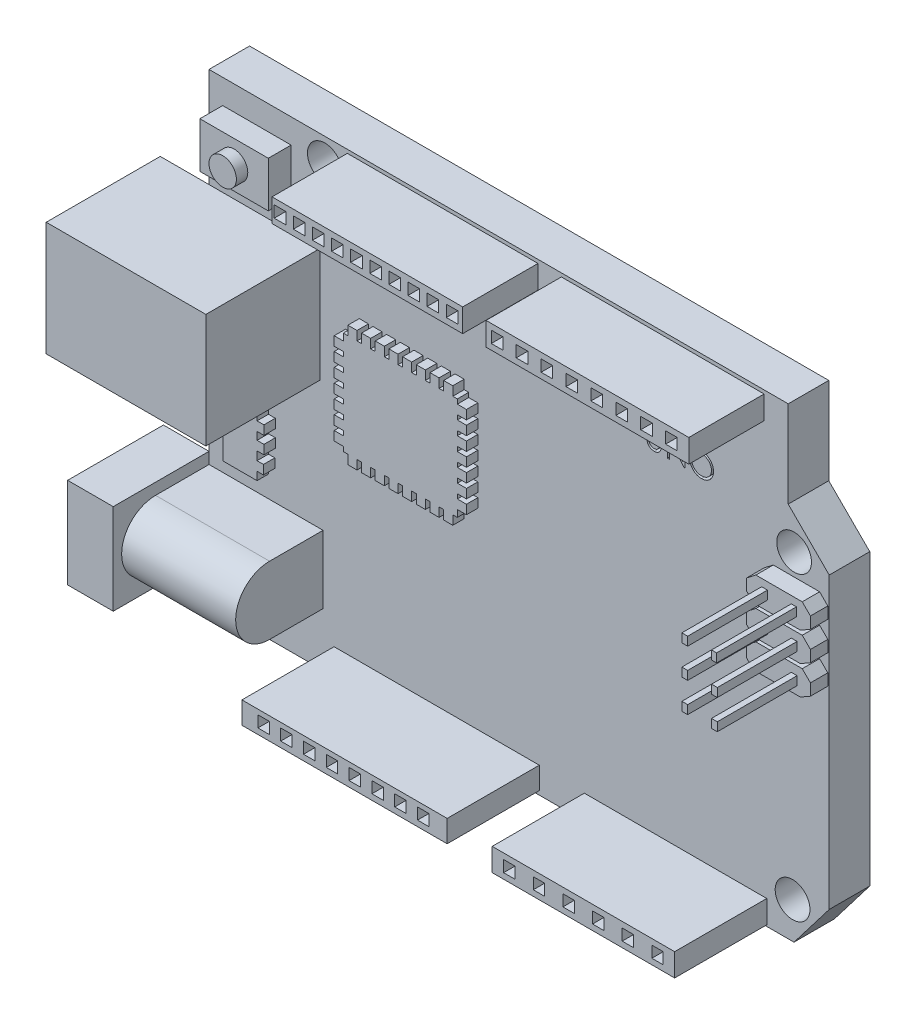
from build123d import *

# Parameters (mm, degrees)
BOSS_EXTRUDE1_DEPTH       = 1.778
CUT_EXTRUDE6_DEPTH        = 6.35
CUT_EXTRUDE6_DEPTH_BACK   = 7.874
SKETCH2_R                 = 0.762
BOSS_EXTRUDE5_DEPTH       = 2.54
SKETCH8_W                 = 8.89
SKETCH8_H                 = 1.016
SKETCH8_W_2               = 0.508
SKETCH8_H_2               = 0.508
SKETCH8_W_3               = 8.360268533
BOSS_EXTRUDE10_DEPTH      = 5.08
SKETCH9_W                 = 0.254
SKETCH9_H                 = 0.381
SKETCH9_W_2               = 0.224
BOSS_EXTRUDE14_DEPTH      = 3.5
SKETCH10_W                = 3
SKETCH10_H                = 2
BOSS_EXTRUDE15_DEPTH      = 1
SKETCH11_R                = 0.6
BOSS_EXTRUDE16_DEPTH      = 0.5
SKETCH21_W                = 7
SKETCH21_H                = 5
BOSS_EXTRUDE20_DEPTH      = 5
CUT_EXTRUDE9_DEPTH        = 6
SKETCH23_W                = 0.676458164
SKETCH23_H                = 1.161684227
BOSS_EXTRUDE21_DEPTH      = 6
BOSS_EXTRUDE22_DEPTH      = 0.5
BOSS_EXTRUDE25_DEPTH      = 1
BOSS_EXTRUDE25_DEPTH_BACK = 21
CUT_EXTRUDE10_START       = -17
CUT_EXTRUDE10_DEPTH       = 17
SKETCH32_W                = 4.2
SKETCH32_H                = 3.973735186
BOSS_EXTRUDE26_DEPTH      = 2
SKETCH33_R                = 1.3
CUT_EXTRUDE11_DEPTH       = 2
BOSS_EXTRUDE27_DEPTH      = 0.04
BOSS_EXTRUDE27_DEPTH_BACK = 2
SKETCH35_R                = 0.2
SKETCH36_W                = 8
SKETCH36_H                = 1
SKETCH36_W_2              = 0.5
SKETCH36_H_2              = 0.5
BOSS_EXTRUDE28_DEPTH      = 4.04
SKETCH39_W                = 9
SKETCH39_H                = 0.965136864
SKETCH39_W_2              = 0.5
SKETCH39_H_2              = 0.5
BOSS_EXTRUDE29_DEPTH      = 4.04
CUT_EXTRUDE15_DEPTH       = 0.5
BOSS_EXTRUDE30_DEPTH      = 0.5


with BuildPart() as part:
    # Sketch1 → Boss-Extrude1 (new body)
    with BuildSketch(Plane.XY):
        Polygon((-21.001524752, 8.06009901), (-21.001524752, -12.25990099), (4.652475248, -12.25990099), (6.197009901, -10.243465347), (6.197009901, 2.456534653), (4.398475248, 4.25009901), (4.398475248, 8.06009901), align=None)
    extrude(amount=BOSS_EXTRUDE1_DEPTH)

    # Sketch2 → Cut-Extrude6 (cut, two sides: drawn at the far end of the back side and taken through both)
    with BuildSketch(Plane.XY.offset(-CUT_EXTRUDE6_DEPTH_BACK)):
        with Locations((4.657234914, 2.557197453)):
            Circle(SKETCH2_R)
        with Locations((-15.921524752, 7.04409901)):
            Circle(SKETCH2_R)
        with Locations((-18.461524752, -11.24390099)):
            Circle(SKETCH2_R)
        with Locations((4.589010092, -10.671936231)):
            Circle(SKETCH2_R)
    extrude(amount=CUT_EXTRUDE6_DEPTH + CUT_EXTRUDE6_DEPTH_BACK, mode=Mode.SUBTRACT)

    # Sketch7 → Boss-Extrude5 (add)
    with BuildSketch(Plane.XY):
        Polygon((3.743027491, 1.610457136), (5.775027491, 1.610457136), (6.134237736, 1.251246892), (6.134237736, 0.743246892), (5.692767379, 0.491914593), (3.641234914, 0.491914593), (3.340205146, 0.79294436), (3.340205146, 1.30094436), align=None)
        Polygon((3.340205146, 0.03094436), (3.743027491, 0.340457136), (5.775027491, 0.340457136), (6.134237736, -0.018753108), (6.134237736, -0.526753108), (5.692767379, -0.778085407), (3.641234914, -0.778085407), (3.340205146, -0.47705564), align=None)
        Polygon((3.340205146, -1.23905564), (3.743027491, -0.929542864), (5.775027491, -0.929542864), (6.134237736, -1.288753108), (6.134237736, -1.796753108), (5.692767379, -2.048085407), (3.641234914, -2.048085407), (3.340205146, -1.74705564), align=None)
    extrude(amount=BOSS_EXTRUDE5_DEPTH)

    # Sketch8 → Boss-Extrude10 (add)
    # profile 1 of 2: a face of its own
    with BuildSketch(Plane.XY):
        with Locations((-1.103862224, 7.39657912)):
            Rectangle(SKETCH8_W, SKETCH8_H)
        with Locations((1.486937776, 7.39657912)):
            Rectangle(SKETCH8_W_2, SKETCH8_H_2, mode=Mode.SUBTRACT)
        with Locations((2.579137776, 7.39657912)):
            Rectangle(SKETCH8_W_2, SKETCH8_H_2, mode=Mode.SUBTRACT)
        with Locations((0.394737776, 7.39657912)):
            Rectangle(SKETCH8_W_2, SKETCH8_H_2, mode=Mode.SUBTRACT)
        with Locations((-0.697462224, 7.39657912)):
            Rectangle(SKETCH8_W_2, SKETCH8_H_2, mode=Mode.SUBTRACT)
        with Locations((-1.789662224, 7.39657912)):
            Rectangle(SKETCH8_W_2, SKETCH8_H_2, mode=Mode.SUBTRACT)
        with Locations((-2.881862224, 7.39657912)):
            Rectangle(SKETCH8_W_2, SKETCH8_H_2, mode=Mode.SUBTRACT)
        with Locations((-3.974062224, 7.39657912)):
            Rectangle(SKETCH8_W_2, SKETCH8_H_2, mode=Mode.SUBTRACT)
        with Locations((-5.066262224, 7.39657912)):
            Rectangle(SKETCH8_W_2, SKETCH8_H_2, mode=Mode.SUBTRACT)
    # profile 2 of 2: a face of its own
    with BuildSketch(Plane.XY):
        with Locations((-10.754714957, 7.39657912)):
            Rectangle(SKETCH8_W_3, SKETCH8_H)
        with Locations((-7.879854404, 7.39657912)):
            Rectangle(SKETCH8_W_2, SKETCH8_H_2, mode=Mode.SUBTRACT)
        with Locations((-7.041654404, 7.39657912)):
            Rectangle(SKETCH8_W_2, SKETCH8_H_2, mode=Mode.SUBTRACT)
        with Locations((-8.718054404, 7.39657912)):
            Rectangle(SKETCH8_W_2, SKETCH8_H_2, mode=Mode.SUBTRACT)
        with Locations((-9.556254404, 7.39657912)):
            Rectangle(SKETCH8_W_2, SKETCH8_H_2, mode=Mode.SUBTRACT)
        with Locations((-10.394454404, 7.39657912)):
            Rectangle(SKETCH8_W_2, SKETCH8_H_2, mode=Mode.SUBTRACT)
        with Locations((-11.232654404, 7.39657912)):
            Rectangle(SKETCH8_W_2, SKETCH8_H_2, mode=Mode.SUBTRACT)
        with Locations((-12.070854404, 7.39657912)):
            Rectangle(SKETCH8_W_2, SKETCH8_H_2, mode=Mode.SUBTRACT)
        with Locations((-12.909054404, 7.39657912)):
            Rectangle(SKETCH8_W_2, SKETCH8_H_2, mode=Mode.SUBTRACT)
        with Locations((-13.747254404, 7.39657912)):
            Rectangle(SKETCH8_W_2, SKETCH8_H_2, mode=Mode.SUBTRACT)
        with Locations((-14.585454404, 7.39657912)):
            Rectangle(SKETCH8_W_2, SKETCH8_H_2, mode=Mode.SUBTRACT)
    extrude(amount=BOSS_EXTRUDE10_DEPTH)

    # Sketch9 → Boss-Extrude14 (add)
    with BuildSketch(Plane.XY.offset(2.54)):
        with Locations((4.124027491, 1.102457136)):
            Rectangle(SKETCH9_W, SKETCH9_H)
        with Locations((5.409027491, 1.102457136)):
            Rectangle(SKETCH9_W_2, SKETCH9_H)
        with Locations((5.424027491, -0.197542864)):
            Rectangle(SKETCH9_W, SKETCH9_H)
        with Locations((4.124027491, -0.197542864)):
            Rectangle(SKETCH9_W, SKETCH9_H)
        with Locations((5.424027491, -1.497542864)):
            Rectangle(SKETCH9_W, SKETCH9_H)
        with Locations((4.124027491, -1.497542864)):
            Rectangle(SKETCH9_W, SKETCH9_H)
    extrude(amount=BOSS_EXTRUDE14_DEPTH)

    # Sketch10 → Boss-Extrude15 (add)
    with BuildSketch(Plane.XY.offset(1.778)):
        with Locations((-18.901524752, 5.986925815)):
            Rectangle(SKETCH10_W, SKETCH10_H)
    extrude(amount=BOSS_EXTRUDE15_DEPTH)

    # Sketch11 → Boss-Extrude16 (add)
    with BuildSketch(Plane.XY.offset(2.778)):
        with Locations((-18.901524752, 5.986925815)):
            Circle(SKETCH11_R)
    extrude(amount=BOSS_EXTRUDE16_DEPTH)

    # Sketch21 → Boss-Extrude20 (add)
    with BuildSketch(Plane.XY.offset(1.778)):
        with Locations((-19.640020469, 1.186961581)):
            Rectangle(SKETCH21_W, SKETCH21_H)
    extrude(amount=BOSS_EXTRUDE20_DEPTH)

    # Sketch22 → Cut-Extrude9 (cut)
    with BuildSketch(Plane.ZY.offset(23.140020469)):
        Polygon((5.444113885, 2.109424234), (5.444113885, 0.255118082), (4.630647808, -0.558347995), (3.111886115, -0.558347995), (3.111886115, 2.941652005), (4.611886115, 2.941652005), align=None)
    extrude(amount=-CUT_EXTRUDE9_DEPTH, mode=Mode.SUBTRACT)

    # Sketch23 → Boss-Extrude21 (add)
    with BuildSketch(Plane.ZY.offset(17.140020469)):
        with Locations((4.244276373, 1.191652005)):
            Rectangle(SKETCH23_W, SKETCH23_H)
    extrude(amount=BOSS_EXTRUDE21_DEPTH)

    # Sketch25 → Boss-Extrude22 (add)
    with BuildSketch(Plane.XY.offset(1.778)):
        Polygon((-19.894913407, -3.505326172), (-18.394913407, -3.505326172), (-18.394913407, -3.734159588), (-18.094167162, -3.734159588), (-18.094167162, -4.134159588), (-18.394913407, -4.134159588), (-18.394913407, -4.473424948), (-18.091551068, -4.473424948), (-18.091551068, -4.873424948), (-18.394913407, -4.873424948), (-18.394913407, -5.248183315), (-18.114536021, -5.248183315), (-18.114536021, -5.648183315), (-18.394913407, -5.648183315), (-18.394913407, -6.005326172), (-19.894913407, -6.005326172), align=None)
    extrude(amount=BOSS_EXTRUDE22_DEPTH)

    # Sketch30 → Boss-Extrude25 (add, two sides: drawn at the far end of the back side and taken through both)
    with BuildSketch(Plane(origin=(0, 0, 0), x_dir=(0, 0, -1), z_dir=(1, 0, 0)).offset(-BOSS_EXTRUDE25_DEPTH_BACK)):
        with BuildLine():
            Line((-4.124266101, -6.943456665), (-1.624266101, -6.943456665))
            Line((-1.624266101, -6.943456665), (-1.624266101, -9.917191851))
            Line((-1.624266101, -9.917191851), (-4.124266101, -9.917191851))
            ThreePointArc((-4.124266101, -9.917191851), (-5.611133694, -8.430324258), (-4.124266101, -6.943456665))
        make_face()
    extrude(amount=BOSS_EXTRUDE25_DEPTH + BOSS_EXTRUDE25_DEPTH_BACK)

    # Sketch31 → Cut-Extrude10 (cut)
    with BuildSketch(Plane(origin=(1, 0, 0), x_dir=(0, 0, -1), z_dir=(1, 0, 0)).offset(CUT_EXTRUDE10_START)):
        with BuildLine():
            Line((-4.124266101, -9.917191851), (-1.778, -9.917191851))
            Line((-1.778, -9.917191851), (-1.778, -6.943456665))
            Line((-1.778, -6.943456665), (-4.124266101, -6.943456665))
            ThreePointArc((-4.124266101, -6.943456665), (-5.611133694, -8.430324258), (-4.124266101, -9.917191851))
        make_face()
    extrude(amount=CUT_EXTRUDE10_DEPTH, mode=Mode.SUBTRACT)

    # Sketch32 → Boss-Extrude26 (add)
    with BuildSketch(Plane.ZY.offset(21)):
        with Locations((3.879314121, -8.430324258)):
            Rectangle(SKETCH32_W, SKETCH32_H)
    extrude(amount=BOSS_EXTRUDE26_DEPTH)

    # Sketch33 → Cut-Extrude11 (cut)
    with BuildSketch(Plane.ZY.offset(23)):
        with Locations((3.879314121, -8.430324258)):
            Circle(SKETCH33_R)
    extrude(amount=-CUT_EXTRUDE11_DEPTH, mode=Mode.SUBTRACT)

    # Sketch35 → Boss-Extrude27 (add, two sides: drawn at the far end of the back side and taken through both)
    with BuildSketch(Plane.ZY.offset(23).offset(-BOSS_EXTRUDE27_DEPTH_BACK)):
        with Locations((3.879314121, -8.430324258)):
            Circle(SKETCH35_R)
    extrude(amount=BOSS_EXTRUDE27_DEPTH + BOSS_EXTRUDE27_DEPTH_BACK)

    # Sketch36 → Boss-Extrude28 (add)
    with BuildSketch(Plane.XY.offset(1.778)):
        with Locations((-0.541927669, -11.696750129)):
            Rectangle(SKETCH36_W, SKETCH36_H)
        with Locations((1.408072331, -11.696750129)):
            Rectangle(SKETCH36_W_2, SKETCH36_H_2, mode=Mode.SUBTRACT)
        with Locations((2.708072331, -11.696750129)):
            Rectangle(SKETCH36_W_2, SKETCH36_H_2, mode=Mode.SUBTRACT)
        with Locations((0.108072331, -11.696750129)):
            Rectangle(SKETCH36_W_2, SKETCH36_H_2, mode=Mode.SUBTRACT)
        with Locations((-1.191927669, -11.696750129)):
            Rectangle(SKETCH36_W_2, SKETCH36_H_2, mode=Mode.SUBTRACT)
        with Locations((-2.491927669, -11.696750129)):
            Rectangle(SKETCH36_W_2, SKETCH36_H_2, mode=Mode.SUBTRACT)
        with Locations((-3.791927669, -11.696750129)):
            Rectangle(SKETCH36_W_2, SKETCH36_H_2, mode=Mode.SUBTRACT)
    extrude(amount=BOSS_EXTRUDE28_DEPTH)

    # Sketch39 → Boss-Extrude29 (add)
    with BuildSketch(Plane.XY.offset(1.778)):
        with Locations((-11.017579704, -11.605130957)):
            Rectangle(SKETCH39_W, SKETCH39_H)
        with Locations((-8.567579704, -11.587699389)):
            Rectangle(SKETCH39_W_2, SKETCH39_H_2, mode=Mode.SUBTRACT)
        with Locations((-7.567579704, -11.587699389)):
            Rectangle(SKETCH39_W_2, SKETCH39_H_2, mode=Mode.SUBTRACT)
        with Locations((-9.567579704, -11.587699389)):
            Rectangle(SKETCH39_W_2, SKETCH39_H_2, mode=Mode.SUBTRACT)
        with Locations((-10.567579704, -11.587699389)):
            Rectangle(SKETCH39_W_2, SKETCH39_H_2, mode=Mode.SUBTRACT)
        with Locations((-11.567579704, -11.587699389)):
            Rectangle(SKETCH39_W_2, SKETCH39_H_2, mode=Mode.SUBTRACT)
        with Locations((-12.567579704, -11.587699389)):
            Rectangle(SKETCH39_W_2, SKETCH39_H_2, mode=Mode.SUBTRACT)
        with Locations((-13.567579704, -11.587699389)):
            Rectangle(SKETCH39_W_2, SKETCH39_H_2, mode=Mode.SUBTRACT)
        with Locations((-14.567579704, -11.587699389)):
            Rectangle(SKETCH39_W_2, SKETCH39_H_2, mode=Mode.SUBTRACT)
    extrude(amount=BOSS_EXTRUDE29_DEPTH)

    # Sketch40 → Cut-Extrude15 (cut)
    # profile 1 of 3: a face of its own
    with BuildSketch(Plane.XY.offset(1.778)):
        with BuildLine():
            Line((-1.80100429, 4.345435627), (-1.711260701, 4.345435627))
            Line((-1.711260701, 4.345435627), (-1.711260701, 3.746276973))
            add(Edge.make_bspline(
                [(-1.711260701, 3.746276973), (-1.711274056, 3.737796763), (-1.7112994, 3.721704103), (-1.71113011, 3.698798874), (-1.710656005, 3.678435314), (-1.710357103, 3.660534929), (-1.70969215, 3.645179859), (-1.709149851, 3.632286913), (-1.708452549, 3.621917141), (-1.707614515, 3.615865447), (-1.70725429, 3.613264153)],
                knots=[0, 0, 0, 0, 1.528628734, 2.90083645, 4.128790002, 5.200304208, 6.127813768, 6.898992206, 7.526736466, 8, 8, 8, 8], degree=3))
            add(Edge.make_bspline(
                [(-1.70725429, 3.613264153), (-1.705775016, 3.603879363), (-1.70289982, 3.585638584), (-1.695572284, 3.559664789), (-1.685338712, 3.536255801), (-1.673212128, 3.514681146), (-1.657231382, 3.495541329), (-1.638087515, 3.477909428), (-1.614893867, 3.462488912), (-1.589105122, 3.448388681), (-1.56130934, 3.4370558), (-1.532906121, 3.428486267), (-1.504322413, 3.423263724), (-1.485186366, 3.422658999), (-1.475683777, 3.422358704)],
                knots=[0, 0, 0, 0, 1.035780045, 2.013197591, 2.933192213, 3.817615948, 4.702609284, 5.640816605, 6.646850145, 7.73207398, 8.84249596, 9.914020372, 10.964143139, 12, 12, 12, 12], degree=3))
            add(Edge.make_bspline(
                [(-1.475683777, 3.422358704), (-1.467525566, 3.422665518), (-1.451256263, 3.423277375), (-1.427082997, 3.427066355), (-1.403540108, 3.433895088), (-1.380511343, 3.442706448), (-1.358925347, 3.454348617), (-1.338770078, 3.467797428), (-1.320780383, 3.483571964), (-1.304363812, 3.501029205), (-1.290068116, 3.520726291), (-1.277676361, 3.542234331), (-1.267526095, 3.565877001), (-1.26251366, 3.58249255), (-1.259938585, 3.591028576)],
                knots=[0, 0, 0, 0, 0.994687771, 1.983630487, 2.973142513, 3.978332533, 4.983357753, 5.956394766, 6.925816176, 7.893390482, 8.871859704, 9.88551698, 10.913711441, 12, 12, 12, 12], degree=3))
            add(Edge.make_bspline(
                [(-1.259938585, 3.591028576), (-1.259081407, 3.59455674), (-1.257171267, 3.602418911), (-1.255386397, 3.615710709), (-1.25352739, 3.631393384), (-1.252237513, 3.649579616), (-1.250980021, 3.670208466), (-1.250227715, 3.693387396), (-1.249879991, 3.719032242), (-1.249776368, 3.736928574), (-1.249722239, 3.746276973)],
                knots=[0, 0, 0, 0, 0.558680831, 1.244966039, 2.062412453, 2.990489873, 4.051219941, 5.244515665, 6.560634259, 8, 8, 8, 8], degree=3))
            Line((-1.249722239, 3.746276973), (-1.249722239, 4.345435627))
            Line((-1.249722239, 4.345435627), (-1.159978649, 4.345435627))
            Line((-1.159978649, 4.345435627), (-1.159978649, 3.741469281))
            add(Edge.make_bspline(
                [(-1.159978649, 3.741469281), (-1.160051255, 3.73058403), (-1.16019295, 3.7093408), (-1.161421686, 3.678211841), (-1.163380829, 3.648682418), (-1.166148854, 3.620748561), (-1.169816569, 3.59451023), (-1.173895203, 3.569737439), (-1.179089356, 3.546608013), (-1.185156042, 3.524941608), (-1.192091341, 3.504317175), (-1.201074527, 3.484743285), (-1.211195812, 3.465624886), (-1.223199999, 3.44725114), (-1.236688965, 3.429540696), (-1.251960874, 3.412600961), (-1.268510634, 3.396161233), (-1.286613366, 3.380643214), (-1.305970659, 3.366412164), (-1.326524932, 3.353898515), (-1.348118295, 3.343320338), (-1.370694617, 3.334612931), (-1.394263532, 3.328065903), (-1.418825635, 3.323187287), (-1.444436833, 3.320415202), (-1.461855306, 3.320003222), (-1.470675765, 3.319794602)],
                knots=[0, 0, 0, 0, 1.316592851, 2.569410997, 3.76748051, 4.895814652, 5.963796859, 6.97159953, 7.931736103, 8.829262218, 9.692595152, 10.560224239, 11.431080259, 12.30701507, 13.211635791, 14.121146779, 15.063487852, 16.031507147, 17.00238618, 17.966455255, 18.938106653, 19.907068911, 20.888905087, 21.893141452, 22.933117798, 24, 24, 24, 24], degree=3))
            add(Edge.make_bspline(
                [(-1.470675765, 3.319794602), (-1.480295508, 3.32001882), (-1.499169411, 3.320458736), (-1.526980287, 3.322979522), (-1.553641486, 3.327727635), (-1.579434594, 3.333773333), (-1.60400845, 3.342111544), (-1.627692291, 3.351853865), (-1.650080486, 3.363818797), (-1.671536237, 3.377131195), (-1.691486167, 3.392109663), (-1.709799711, 3.408435427), (-1.726507103, 3.425846963), (-1.74132673, 3.444532782), (-1.754504126, 3.464347555), (-1.765855615, 3.485347338), (-1.775602257, 3.507524), (-1.780632704, 3.5229392), (-1.783175765, 3.530732102)],
                knots=[0, 0, 0, 0, 1.13879206, 2.234305948, 3.301075583, 4.341971843, 5.366689343, 6.369221514, 7.369726634, 8.367512178, 9.355451585, 10.318319045, 11.268648973, 12.207971039, 13.137398894, 14.081662264, 15.030215811, 16, 16, 16, 16], degree=3))
            add(Edge.make_bspline(
                [(-1.783175765, 3.530732102), (-1.784654953, 3.536055694), (-1.787863345, 3.547602685), (-1.791299144, 3.566713111), (-1.794187453, 3.588717373), (-1.796903327, 3.613616978), (-1.798505886, 3.641431226), (-1.799910869, 3.672148059), (-1.801014188, 3.705804619), (-1.801007682, 3.729248767), (-1.80100429, 3.741469281)],
                knots=[0, 0, 0, 0, 0.625038921, 1.35572334, 2.194682327, 3.136881307, 4.189498639, 5.346923369, 6.617055217, 8, 8, 8, 8], degree=3))
            Line((-1.80100429, 3.741469281), (-1.80100429, 4.345435627))
        make_face()
    # profile 2 of 3: a face of its own
    with BuildSketch(Plane.XY.offset(1.778)):
        Polygon((-0.903568393, 3.345435627), (-0.903568393, 4.345435627), (-0.884738265, 4.345435627), (-0.224081213, 3.558376332), (-0.224081213, 4.345435627), (-0.134337624, 4.345435627), (-0.134337624, 3.345435627), (-0.154770316, 3.345435627), (-0.813824803, 4.130692037), (-0.813824803, 3.345435627), align=None)
    # profile 3 of 3: a face of its own
    with BuildSketch(Plane.XY.offset(1.778)):
        with BuildLine():
            add(Edge.make_bspline(
                [(0.590021351, 4.371076653), (0.608537952, 4.370607659), (0.644906086, 4.369686516), (0.698356057, 4.362635343), (0.749383227, 4.35043666), (0.798403266, 4.334190094), (0.844829831, 4.312517412), (0.889012372, 4.286321656), (0.930845764, 4.255328382), (0.969766159, 4.219777174), (1.005382431, 4.181096187), (1.036761255, 4.139816784), (1.063059053, 4.096188555), (1.084654993, 4.050342604), (1.101597453, 4.002382613), (1.113288608, 3.952052898), (1.120756651, 3.899679558), (1.12162973, 3.863957596), (1.122072633, 3.845836268)],
                knots=[0, 0, 0, 0, 1.065120563, 2.091984664, 3.0946048, 4.079830382, 5.057816894, 6.036188127, 7.030412546, 8.04752943, 9.064399622, 10.05169764, 11.02544977, 11.989514704, 12.962713494, 13.945757189, 14.957906945, 16, 16, 16, 16], degree=3))
            add(Edge.make_bspline(
                [(1.122072633, 3.845836268), (1.121629795, 3.827848426), (1.12075691, 3.792392306), (1.113280117, 3.740351322), (1.101554117, 3.690325409), (1.084812326, 3.64239808), (1.063319332, 3.596518776), (1.036846426, 3.552808217), (1.005663223, 3.511252075), (0.970175552, 3.472305599), (0.93148954, 3.436592036), (0.889995178, 3.405472357), (0.846625658, 3.378694036), (0.800822884, 3.357327272), (0.753194302, 3.340249581), (0.703313638, 3.328605972), (0.651414623, 3.321095388), (0.616022907, 3.320232955), (0.598034171, 3.319794602)],
                knots=[0, 0, 0, 0, 1.043624062, 2.057103931, 3.04512605, 4.022047818, 4.998200453, 5.980619268, 6.982898556, 8.009068085, 9.034988726, 10.034168286, 11.015286542, 11.987931943, 12.962482838, 13.94673481, 14.956375938, 16, 16, 16, 16], degree=3))
            add(Edge.make_bspline(
                [(0.598034171, 3.319794602), (0.579912937, 3.320237283), (0.544191161, 3.321109927), (0.491752008, 3.328590329), (0.441386939, 3.340287844), (0.393239981, 3.357004826), (0.347284287, 3.378609749), (0.303429978, 3.404953857), (0.261853078, 3.436213041), (0.222898294, 3.471689205), (0.187255666, 3.510309648), (0.156181558, 3.551690864), (0.129831526, 3.595020994), (0.108299145, 3.640420287), (0.091252157, 3.687669271), (0.079622209, 3.737083121), (0.072097651, 3.788380123), (0.071230552, 3.823306665), (0.070790582, 3.841028576)],
                knots=[0, 0, 0, 0, 1.053102029, 2.075944431, 3.073151272, 4.055350789, 5.033113405, 6.020478099, 7.024410459, 8.052272461, 9.079885166, 10.07527673, 11.055994387, 12.023226415, 12.992069828, 13.970394897, 14.97016774, 16, 16, 16, 16], degree=3))
            add(Edge.make_bspline(
                [(0.070790582, 3.841028576), (0.070943335, 3.852923624), (0.071246913, 3.876563659), (0.074901683, 3.911668402), (0.080205026, 3.94620859), (0.087805572, 3.980086004), (0.097746049, 4.013217714), (0.109475199, 4.045832218), (0.123800869, 4.077598996), (0.13999534, 4.108668536), (0.158070143, 4.138556509), (0.178034642, 4.166807819), (0.199187605, 4.193659532), (0.222377146, 4.218415819), (0.246838987, 4.241796864), (0.272969953, 4.263443354), (0.300610594, 4.283550483), (0.329879845, 4.301670581), (0.360056495, 4.318058905), (0.391164146, 4.332122291), (0.422780309, 4.344192594), (0.455053066, 4.353975687), (0.487896715, 4.361699126), (0.521382939, 4.36695837), (0.555485061, 4.370622461), (0.578459723, 4.370924604), (0.590021351, 4.371076653)],
                knots=[0, 0, 0, 0, 1.037015668, 2.060948919, 3.074880161, 4.083647147, 5.086022904, 6.090072063, 7.104153813, 8.122640571, 9.144368836, 10.147691507, 11.138137339, 12.123020368, 13.103399296, 14.087645067, 15.080126199, 16.082011238, 17.087798457, 18.072939717, 19.057185487, 20.037253025, 21.01195951, 21.997135196, 22.992090687, 24, 24, 24, 24], degree=3))
        make_face()
        with BuildLine():
            add(Edge.make_bspline(
                [(0.594428402, 4.26851255), (0.584938507, 4.268396867), (0.56604944, 4.268166607), (0.537968144, 4.265133546), (0.510256163, 4.26081072), (0.482907774, 4.254644572), (0.456037405, 4.246243414), (0.429394594, 4.236574583), (0.403222293, 4.224797128), (0.377606905, 4.211490641), (0.352774026, 4.196762378), (0.329341826, 4.180484731), (0.307249642, 4.163039429), (0.286551565, 4.144385761), (0.267308373, 4.124428732), (0.249141316, 4.103470893), (0.232778578, 4.08091321), (0.217782699, 4.05736738), (0.204363316, 4.032864071), (0.192430358, 4.007661253), (0.182669212, 3.981553343), (0.174708533, 3.954823583), (0.168108587, 3.927514309), (0.163927466, 3.899418352), (0.160861078, 3.870676892), (0.160643979, 3.851253505), (0.160534171, 3.841429217)],
                knots=[0, 0, 0, 0, 1.008559885, 2.007477868, 2.99961109, 3.989939068, 4.984837346, 5.991145699, 7.001802488, 8.033829008, 9.059044045, 10.069351652, 11.065060232, 12.050310815, 13.029377138, 14.011219647, 14.996725999, 15.989392538, 16.977580475, 17.965360261, 18.951710183, 19.937753436, 20.929683414, 21.935841486, 22.955955122, 24, 24, 24, 24], degree=3))
            add(Edge.make_bspline(
                [(0.160534171, 3.841429217), (0.160898418, 3.826982868), (0.161615003, 3.798562431), (0.167888594, 3.75691439), (0.177552015, 3.716889165), (0.191796977, 3.678705762), (0.209611439, 3.642035967), (0.231619121, 3.60720508), (0.257693146, 3.574203688), (0.287311296, 3.543262182), (0.319689213, 3.515020524), (0.354069993, 3.490230979), (0.390085309, 3.469256621), (0.427829081, 3.452169458), (0.467099807, 3.438629533), (0.508150535, 3.429349924), (0.55070781, 3.423242651), (0.579716568, 3.422656149), (0.594428402, 3.422358704)],
                knots=[0, 0, 0, 0, 1.032063989, 2.030389145, 3.003944642, 3.970395727, 4.937377036, 5.913328081, 6.909231446, 7.93887556, 8.970685674, 9.976071282, 10.964166581, 11.944589148, 12.933237628, 13.927779006, 14.949070134, 16, 16, 16, 16], degree=3))
            add(Edge.make_bspline(
                [(0.594428402, 3.422358704), (0.604316831, 3.422494562), (0.623928556, 3.42276401), (0.653098705, 3.425477918), (0.681743337, 3.429829881), (0.709822274, 3.436095782), (0.737303649, 3.443937841), (0.764302164, 3.453254335), (0.790530247, 3.464877536), (0.816318772, 3.477719808), (0.841003412, 3.492359853), (0.86456785, 3.508085039), (0.88641813, 3.525504645), (0.907100722, 3.543881162), (0.926422919, 3.563585119), (0.944254057, 3.584590897), (0.960534095, 3.607031084), (0.97552428, 3.6305412), (0.98889664, 3.655111558), (1.000547812, 3.680405752), (1.010432416, 3.706361498), (1.018411989, 3.733016232), (1.024664978, 3.760319332), (1.028973527, 3.788307354), (1.031987366, 3.816924309), (1.032214531, 3.836279697), (1.032329043, 3.846036589)],
                knots=[0, 0, 0, 0, 1.047197238, 2.076906641, 3.100256066, 4.114471768, 5.12198147, 6.126382909, 7.136867548, 8.15857795, 9.17633901, 10.174870724, 11.156907918, 12.133735059, 13.104061851, 14.077631395, 15.04955518, 16.038496417, 17.029181396, 18.010275684, 18.986308667, 19.968651475, 20.955262928, 21.950658345, 22.966943676, 24, 24, 24, 24], degree=3))
            add(Edge.make_bspline(
                [(1.032329043, 3.846036589), (1.032214439, 3.855726733), (1.031987102, 3.874948919), (1.028974966, 3.903366295), (1.024660426, 3.931152927), (1.018442509, 3.958199728), (1.01042818, 3.984513592), (1.000546085, 4.010069806), (0.988893143, 4.034963576), (0.975519364, 4.059133375), (0.960486272, 4.082326157), (0.944059345, 4.104498275), (0.92595496, 4.125233344), (0.906690382, 4.145043257), (0.885784414, 4.163505511), (0.863331759, 4.180626231), (0.839604994, 4.196818595), (0.814482927, 4.211425899), (0.788556083, 4.224915679), (0.761952095, 4.236473109), (0.734972352, 4.246293714), (0.707685463, 4.25466999), (0.679861755, 4.26078657), (0.651689232, 4.265137441), (0.623206872, 4.268165552), (0.604051667, 4.268396517), (0.594428402, 4.26851255)],
                knots=[0, 0, 0, 0, 1.02996197, 2.043119294, 3.035359645, 4.018872909, 4.991431989, 5.957985074, 6.929999688, 7.912076566, 8.892894881, 9.867085534, 10.843653904, 11.817741046, 12.803660682, 13.806313499, 14.818574707, 15.856120519, 16.894564902, 17.924820532, 18.937903209, 19.946497019, 20.957711757, 21.963978472, 22.977135795, 24, 24, 24, 24], degree=3))
        make_face(mode=Mode.SUBTRACT)
    extrude(amount=-CUT_EXTRUDE15_DEPTH, mode=Mode.SUBTRACT)

    # Sketch42 → Boss-Extrude30 (add)
    with BuildSketch(Plane.XY.offset(1.778)):
        Polygon((-9.212395356, -1.709075838), (-9.612395356, -1.709075838), (-9.612395356, -1.704801008), (-9.612395356, -1.609075838), (-9.612395356, -1.509075838), (-9.212395356, -1.509075838), (-9.212395356, -1.109075838), (-9.612395356, -1.109075838), (-9.612395356, -0.909075838), (-9.212395356, -0.909075838), (-9.212395356, -0.509075838), (-9.612395356, -0.509075838), (-9.612395356, -0.309075838), (-9.212395356, -0.309075838), (-9.212395356, 0.090924162), (-9.612395356, 0.090924162), (-9.612395356, 0.290924162), (-9.212395356, 0.290924162), (-9.212395356, 0.690924162), (-9.612395356, 0.690924162), (-9.612395356, 0.790924162), (-9.612395356, 0.890924162), (-9.212395356, 0.890924162), (-9.212395356, 1.290924162), (-9.612395356, 1.290924162), (-9.612395356, 1.490924162), (-9.812395356, 1.490924162), (-9.812395356, 1.890924162), (-10.212395356, 1.890924162), (-10.212395356, 1.490924162), (-10.412395356, 1.490924162), (-10.412395356, 1.890924162), (-10.812395356, 1.890924162), (-10.812395356, 1.490924162), (-11.012395356, 1.490924162), (-11.012395356, 1.890924162), (-11.412395356, 1.890924162), (-11.412395356, 1.490924162), (-11.612395356, 1.490924162), (-11.612395356, 1.890924162), (-12.012395356, 1.890924162), (-12.012395356, 1.490924162), (-12.212395356, 1.490924162), (-12.212395356, 1.890924162), (-12.612395356, 1.890924162), (-12.612395356, 1.490924162), (-12.812395356, 1.490924162), (-12.812395356, 1.890924162), (-13.212395356, 1.890924162), (-13.212395356, 1.490924162), (-13.412395356, 1.490924162), (-13.412395356, 1.890924162), (-13.812395356, 1.890924162), (-13.812395356, 1.490924162), (-14.012395356, 1.490924162), (-14.012395356, 1.890924162), (-14.412395356, 1.890924162), (-14.412395356, 1.490924162), (-14.612395356, 1.490924162), (-14.612395356, 1.190924162), (-15.012395356, 1.190924162), (-15.012395356, 0.790924162), (-14.612395356, 0.790924162), (-14.612395356, 0.590924162), (-15.012395356, 0.590924162), (-15.012395356, 0.190924162), (-14.612395356, 0.190924162), (-14.612395356, -0.009075838), (-15.012395356, -0.009075838), (-15.012395356, -0.409075838), (-14.612395356, -0.409075838), (-14.612395356, -0.609075838), (-15.012395356, -0.609075838), (-15.012395356, -1.009075838), (-14.612395356, -1.009075838), (-14.612395356, -1.209075838), (-15.012395356, -1.209075838), (-15.012395356, -1.609075838), (-14.612395356, -1.609075838), (-14.612395356, -1.809075838), (-15.012395356, -1.809075838), (-15.012395356, -2.209075838), (-14.612395356, -2.209075838), (-14.612395356, -2.409075838), (-15.012395356, -2.409075838), (-15.012395356, -2.809075838), (-14.612395356, -2.809075838), (-14.612395356, -3.009075838), (-14.412395356, -3.009075838), (-14.412395356, -3.409075838), (-14.012395356, -3.409075838), (-14.012395356, -3.009075838), (-13.812395356, -3.009075838), (-13.812395356, -3.409075838), (-13.412395356, -3.409075838), (-13.412395356, -3.009075838), (-13.312395356, -3.009075838), (-13.212395356, -3.009075838), (-13.212395356, -3.409075838), (-12.812395356, -3.409075838), (-12.812395356, -3.009075838), (-12.712395356, -3.009075838), (-12.612395356, -3.009075838), (-12.612395356, -3.409075838), (-12.212395356, -3.409075838), (-12.212395356, -3.009075838), (-12.012395356, -3.009075838), (-12.012395356, -3.409075838), (-11.612395356, -3.409075838), (-11.612395356, -3.009075838), (-11.412395356, -3.009075838), (-11.412395356, -3.409075838), (-11.012395356, -3.409075838), (-11.012395356, -3.009075838), (-10.812395356, -3.009075838), (-10.812395356, -3.409075838), (-10.412395356, -3.409075838), (-10.412395356, -3.009075838), (-10.312395356, -3.009075838), (-10.212395356, -3.009075838), (-10.212395356, -3.409075838), (-9.812395356, -3.409075838), (-9.812395356, -3.009075838), (-9.612395356, -3.009075838), (-9.612395356, -2.809075838), (-9.612395356, -2.709075838), (-9.212395356, -2.709075838), (-9.212395356, -2.309075838), (-9.612395356, -2.309075838), (-9.612395356, -2.182562774), (-9.612395356, -2.109075838), (-9.212395356, -2.109075838), align=None)
    extrude(amount=BOSS_EXTRUDE30_DEPTH)


solid = part.part
